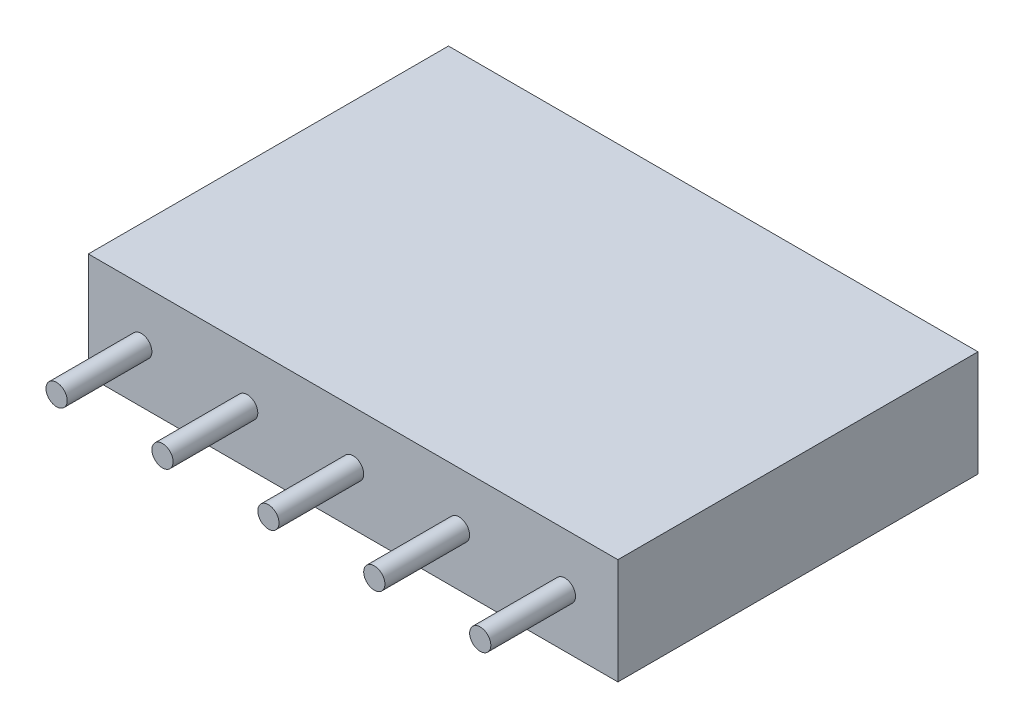
from build123d import *

# Parameters (mm, degrees)
ESQUISSE1_W                = 2.5
ESQUISSE1_H                = 2.5
BOSS_EXTRU_1_DEPTH         = 8.5
ESQUISSE2_R                = 0.25
BOSS_EXTRU_2_DEPTH         = 2
ESQUISSE3_R                = 0.25
ENL_V_MAT_EXTRU_2_DEPTH    = 4
R_P_TITION_LIN_AIRE1_COUNT = 5
R_P_TITION_LIN_AIRE1_PITCH = 2.5


with BuildPart() as part:
    # Esquisse1 → Boss.-Extru.1 (new body)
    with BuildSketch(Plane.XY):
        with Locations((-1.25, 1.25)):
            Rectangle(ESQUISSE1_W, ESQUISSE1_H)
    boss_extru_1 = extrude(amount=BOSS_EXTRU_1_DEPTH)

    # Esquisse2 → Boss.-Extru.2 (add)
    with BuildSketch(Plane.XY.offset(8.5)):
        with Locations((-1.25, 1.25)):
            Circle(ESQUISSE2_R)
    boss_extru_2 = extrude(amount=BOSS_EXTRU_2_DEPTH)

    # Esquisse3 → Enlèv. mat.-Extru.2 (cut)
    with BuildSketch(Plane(origin=(0, 0, 0), x_dir=(-1, 0, 0), z_dir=(0, 0, -1))):
        with Locations(Location((1.25, 1.25, 0), (0, 0, 180))):
            Circle(ESQUISSE3_R)
    enl_v_mat_extru_2 = extrude(amount=-ENL_V_MAT_EXTRU_2_DEPTH, mode=Mode.SUBTRACT)

    # Répétition linéaire1: Boss.-Extru.1, Boss.-Extru.2, Enlèv. mat.-Extru.2 ×5
    with Locations(*[(-i * R_P_TITION_LIN_AIRE1_PITCH, 0, 0) for i in range(1, R_P_TITION_LIN_AIRE1_COUNT)]):
        add(boss_extru_1)
        add(boss_extru_2)
        add(enl_v_mat_extru_2, mode=Mode.SUBTRACT)


solid = part.part
